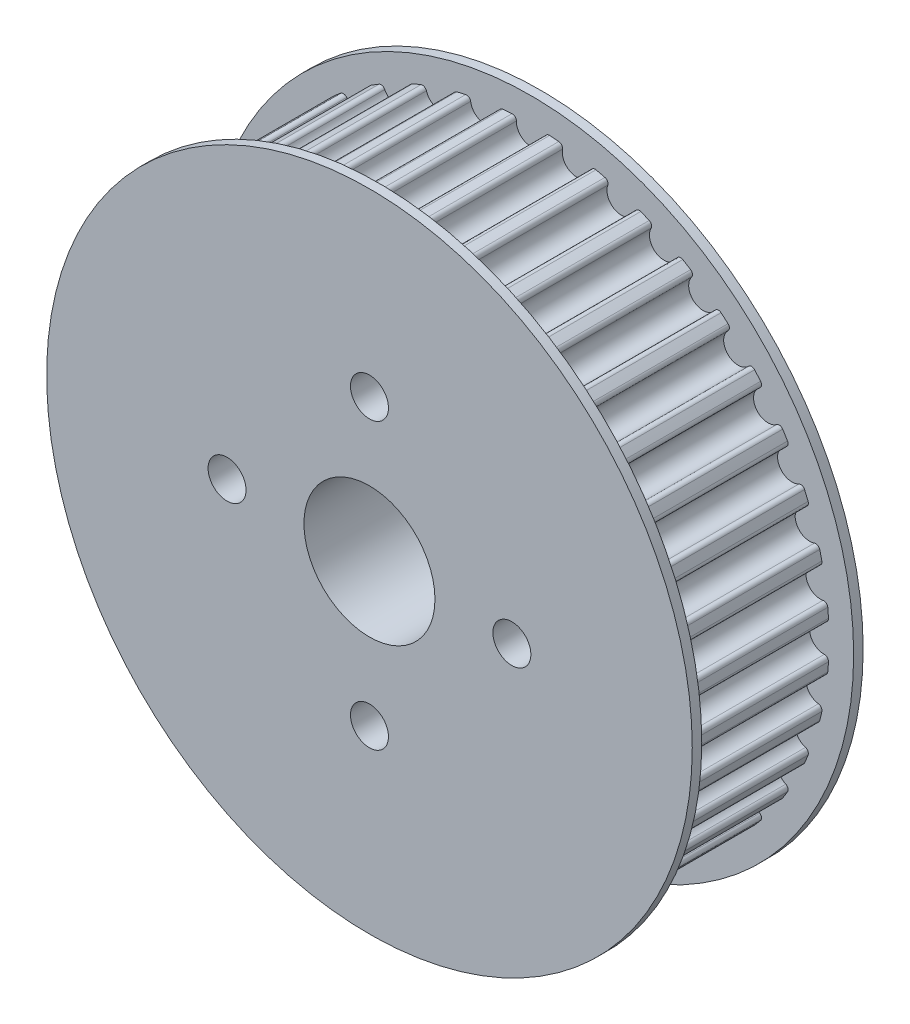
from build123d import *

# Parameters (mm, degrees)
BOSS_EXTRUDE1_DEPTH = 16
SKETCH2_R           = 34
BOSS_EXTRUDE2_DEPTH = 1
SKETCH3_R           = 6.9
SKETCH3_R_2         = 2
CUT_EXTRUDE1_DEPTH  = 52.341990612


with BuildPart() as part:
    # Sketch1 → Boss-Extrude1 (new body)
    with BuildSketch(Plane.XY):
        with BuildLine():
            ThreePointArc((0, 29.35), (1.090209609, 29.808666089), (1.524626197, 30.908763267))
            ThreePointArc((1.524626197, 30.908763267), (1.656759933, 31.228506655), (1.981649395, 31.347426779))
            ThreePointArc((1.981649395, 31.347426779), (2.464400197, 31.313173453), (2.946565936, 31.2714862))
            ThreePointArc((2.946565936, 31.2714862), (3.248852264, 31.103206271), (3.329340328, 30.766729184))
            ThreePointArc((3.329340328, 30.766729184), (3.586315414, 29.612218302), (4.591351549, 28.988652796))
            ThreePointArc((4.591351549, 28.988652796), (5.739890053, 29.271125588), (6.341051366, 30.289721017))
            ThreePointArc((6.341051366, 30.289721017), (6.521577201, 30.584857564), (6.861069941, 30.651489675))
            ThreePointArc((6.861069941, 30.651489675), (7.332518879, 30.5421392), (7.802227035, 30.425537847))
            ThreePointArc((7.802227035, 30.425537847), (8.074466935, 30.212041723), (8.101327445, 29.86711612))
            ThreePointArc((8.101327445, 29.86711612), (8.174533449, 28.686619423), (9.069648785, 27.913508753))
            ThreePointArc((9.069648785, 27.913508753), (10.248235354, 28.01283283), (11.001338804, 28.92484531))
            ThreePointArc((11.001338804, 28.92484531), (11.225811595, 29.188107774), (11.571548174, 29.200811168))
            ThreePointArc((11.571548174, 29.200811168), (12.020086611, 29.019056116), (12.46577141, 28.830411776))
            ThreePointArc((12.46577141, 28.830411776), (12.701261433, 28.57695644), (12.673832993, 28.232075534))
            ThreePointArc((12.673832993, 28.232075534), (12.56146734, 27.054660768), (13.324621167, 26.151041485))
            ThreePointArc((13.324621167, 26.151041485), (14.504235088, 26.064771158), (15.390736771, 26.847743916))
            ThreePointArc((15.390736771, 26.847743916), (15.653629251, 27.072649901), (15.997096488, 27.031111778))
            ThreePointArc((15.997096488, 27.031111778), (16.411679918, 26.781427562), (16.822367121, 26.525385284))
            ThreePointArc((16.822367121, 26.525385284), (17.015308722, 26.238211648), (16.934266711, 25.901867552))
            ThreePointArc((16.934266711, 25.901867552), (16.639096217, 24.756526576), (17.251497155, 23.744648785))
            ThreePointArc((17.251497155, 23.744648785), (18.403092419, 23.474908316), (19.401163718, 24.109561964))
            ThreePointArc((19.401163718, 24.109561964), (19.696002604, 24.290573538), (20.028743195, 24.195816705))
            ThreePointArc((20.028743195, 24.195816705), (20.399163198, 23.884351379), (20.764740323, 23.567215773))
            ThreePointArc((20.764740323, 23.567215773), (20.910382639, 23.253395005), (20.777722581, 22.933869627))
            ThreePointArc((20.777722581, 22.933869627), (20.307015323, 21.848804537), (20.753584028, 20.753584028))
            ThreePointArc((20.753584028, 20.753584028), (21.848804537, 20.307015323), (22.933869627, 20.777722581))
            ThreePointArc((22.933869627, 20.777722581), (23.253395005, 20.910382639), (23.567215773, 20.764740323))
            ThreePointArc((23.567215773, 20.764740323), (23.884351379, 20.399163198), (24.195816705, 20.028743195))
            ThreePointArc((24.195816705, 20.028743195), (24.290573538, 19.696002604), (24.109561964, 19.401163718))
            ThreePointArc((24.109561964, 19.401163718), (23.474908316, 18.403092419), (23.744648785, 17.251497155))
            ThreePointArc((23.744648785, 17.251497155), (24.756526576, 16.639096217), (25.901867552, 16.934266711))
            ThreePointArc((25.901867552, 16.934266711), (26.238211648, 17.015308722), (26.525385284, 16.822367121))
            ThreePointArc((26.525385284, 16.822367121), (26.781427562, 16.411679918), (27.031111778, 15.997096488))
            ThreePointArc((27.031111778, 15.997096488), (27.072649901, 15.653629251), (26.847743916, 15.390736771))
            ThreePointArc((26.847743916, 15.390736771), (26.064771158, 14.504235088), (26.151041485, 13.324621167))
            ThreePointArc((26.151041485, 13.324621167), (27.054660768, 12.56146734), (28.232075534, 12.673832993))
            ThreePointArc((28.232075534, 12.673832993), (28.57695644, 12.701261433), (28.830411776, 12.46577141))
            ThreePointArc((28.830411776, 12.46577141), (29.019056116, 12.020086611), (29.200811168, 11.571548174))
            ThreePointArc((29.200811168, 11.571548174), (29.188107774, 11.225811595), (28.92484531, 11.001338804))
            ThreePointArc((28.92484531, 11.001338804), (28.01283283, 10.248235354), (27.913508753, 9.069648785))
            ThreePointArc((27.913508753, 9.069648785), (28.686619423, 8.174533449), (29.86711612, 8.101327445))
            ThreePointArc((29.86711612, 8.101327445), (30.212041723, 8.074466935), (30.425537847, 7.802227035))
            ThreePointArc((30.425537847, 7.802227035), (30.5421392, 7.332518879), (30.651489675, 6.861069941))
            ThreePointArc((30.651489675, 6.861069941), (30.584857564, 6.521577201), (30.289721017, 6.341051366))
            ThreePointArc((30.289721017, 6.341051366), (29.271125588, 5.739890053), (28.988652796, 4.591351549))
            ThreePointArc((28.988652796, 4.591351549), (29.612218302, 3.586315414), (30.766729184, 3.329340328))
            ThreePointArc((30.766729184, 3.329340328), (31.103206271, 3.248852264), (31.2714862, 2.946565936))
            ThreePointArc((31.2714862, 2.946565936), (31.313173453, 2.464400197), (31.347426779, 1.981649395))
            ThreePointArc((31.347426779, 1.981649395), (31.228506655, 1.656759933), (30.908763267, 1.524626197))
            ThreePointArc((30.908763267, 1.524626197), (29.808666089, 1.090209609), (29.35, 0))
            ThreePointArc((29.35, 0), (29.808666089, -1.090209609), (30.908763267, -1.524626197))
            ThreePointArc((30.908763267, -1.524626197), (31.228506655, -1.656759933), (31.347426779, -1.981649395))
            ThreePointArc((31.347426779, -1.981649395), (31.313173453, -2.464400197), (31.2714862, -2.946565936))
            ThreePointArc((31.2714862, -2.946565936), (31.103206271, -3.248852264), (30.766729184, -3.329340328))
            ThreePointArc((30.766729184, -3.329340328), (29.612218302, -3.586315414), (28.988652796, -4.591351549))
            ThreePointArc((28.988652796, -4.591351549), (29.271125588, -5.739890053), (30.289721017, -6.341051366))
            ThreePointArc((30.289721017, -6.341051366), (30.584857564, -6.521577201), (30.651489675, -6.861069941))
            ThreePointArc((30.651489675, -6.861069941), (30.5421392, -7.332518879), (30.425537847, -7.802227035))
            ThreePointArc((30.425537847, -7.802227035), (30.212041723, -8.074466935), (29.86711612, -8.101327445))
            ThreePointArc((29.86711612, -8.101327445), (28.686619423, -8.174533449), (27.913508753, -9.069648785))
            ThreePointArc((27.913508753, -9.069648785), (28.01283283, -10.248235354), (28.92484531, -11.001338804))
            ThreePointArc((28.92484531, -11.001338804), (29.188107774, -11.225811595), (29.200811168, -11.571548174))
            ThreePointArc((29.200811168, -11.571548174), (29.019056116, -12.020086611), (28.830411776, -12.46577141))
            ThreePointArc((28.830411776, -12.46577141), (28.57695644, -12.701261433), (28.232075534, -12.673832993))
            ThreePointArc((28.232075534, -12.673832993), (27.054660768, -12.56146734), (26.151041485, -13.324621167))
            ThreePointArc((26.151041485, -13.324621167), (26.064771158, -14.504235088), (26.847743916, -15.390736771))
            ThreePointArc((26.847743916, -15.390736771), (27.072649901, -15.653629251), (27.031111778, -15.997096488))
            ThreePointArc((27.031111778, -15.997096488), (26.781427562, -16.411679918), (26.525385284, -16.822367121))
            ThreePointArc((26.525385284, -16.822367121), (26.238211648, -17.015308722), (25.901867552, -16.934266711))
            ThreePointArc((25.901867552, -16.934266711), (24.756526576, -16.639096217), (23.744648785, -17.251497155))
            ThreePointArc((23.744648785, -17.251497155), (23.474908316, -18.403092419), (24.109561964, -19.401163718))
            ThreePointArc((24.109561964, -19.401163718), (24.290573538, -19.696002604), (24.195816705, -20.028743195))
            ThreePointArc((24.195816705, -20.028743195), (23.884351379, -20.399163198), (23.567215773, -20.764740323))
            ThreePointArc((23.567215773, -20.764740323), (23.253395005, -20.910382639), (22.933869627, -20.777722581))
            ThreePointArc((22.933869627, -20.777722581), (21.848804537, -20.307015323), (20.753584028, -20.753584028))
            ThreePointArc((20.753584028, -20.753584028), (20.307015323, -21.848804537), (20.777722581, -22.933869627))
            ThreePointArc((20.777722581, -22.933869627), (20.910382639, -23.253395005), (20.764740323, -23.567215773))
            ThreePointArc((20.764740323, -23.567215773), (20.399163198, -23.884351379), (20.028743195, -24.195816705))
            ThreePointArc((20.028743195, -24.195816705), (19.696002604, -24.290573538), (19.401163718, -24.109561964))
            ThreePointArc((19.401163718, -24.109561964), (18.403092419, -23.474908316), (17.251497155, -23.744648785))
            ThreePointArc((17.251497155, -23.744648785), (16.639096217, -24.756526576), (16.934266711, -25.901867552))
            ThreePointArc((16.934266711, -25.901867552), (17.015308722, -26.238211648), (16.822367121, -26.525385284))
            ThreePointArc((16.822367121, -26.525385284), (16.411679918, -26.781427562), (15.997096488, -27.031111778))
            ThreePointArc((15.997096488, -27.031111778), (15.653629251, -27.072649901), (15.390736771, -26.847743916))
            ThreePointArc((15.390736771, -26.847743916), (14.504235088, -26.064771158), (13.324621167, -26.151041485))
            ThreePointArc((13.324621167, -26.151041485), (12.56146734, -27.054660768), (12.673832993, -28.232075534))
            ThreePointArc((12.673832993, -28.232075534), (12.701261433, -28.57695644), (12.46577141, -28.830411776))
            ThreePointArc((12.46577141, -28.830411776), (12.020086611, -29.019056116), (11.571548174, -29.200811168))
            ThreePointArc((11.571548174, -29.200811168), (11.225811595, -29.188107774), (11.001338804, -28.92484531))
            ThreePointArc((11.001338804, -28.92484531), (10.248235354, -28.01283283), (9.069648785, -27.913508753))
            ThreePointArc((9.069648785, -27.913508753), (8.174533449, -28.686619423), (8.101327445, -29.86711612))
            ThreePointArc((8.101327445, -29.86711612), (8.074466935, -30.212041723), (7.802227035, -30.425537847))
            ThreePointArc((7.802227035, -30.425537847), (7.332518879, -30.5421392), (6.861069941, -30.651489675))
            ThreePointArc((6.861069941, -30.651489675), (6.521577201, -30.584857564), (6.341051366, -30.289721017))
            ThreePointArc((6.341051366, -30.289721017), (5.739890053, -29.271125588), (4.591351549, -28.988652796))
            ThreePointArc((4.591351549, -28.988652796), (3.586315414, -29.612218302), (3.329340328, -30.766729184))
            ThreePointArc((3.329340328, -30.766729184), (3.248852264, -31.103206271), (2.946565936, -31.2714862))
            ThreePointArc((2.946565936, -31.2714862), (2.464400197, -31.313173453), (1.981649395, -31.347426779))
            ThreePointArc((1.981649395, -31.347426779), (1.656759933, -31.228506655), (1.524626197, -30.908763267))
            ThreePointArc((1.524626197, -30.908763267), (1.090209609, -29.808666089), (0, -29.35))
            ThreePointArc((0, -29.35), (-1.090209609, -29.808666089), (-1.524626197, -30.908763267))
            ThreePointArc((-1.524626197, -30.908763267), (-1.656759933, -31.228506655), (-1.981649395, -31.347426779))
            ThreePointArc((-1.981649395, -31.347426779), (-2.464400197, -31.313173453), (-2.946565936, -31.2714862))
            ThreePointArc((-2.946565936, -31.2714862), (-3.248852264, -31.103206271), (-3.329340328, -30.766729184))
            ThreePointArc((-3.329340328, -30.766729184), (-3.586315414, -29.612218302), (-4.591351549, -28.988652796))
            ThreePointArc((-4.591351549, -28.988652796), (-5.739890053, -29.271125588), (-6.341051366, -30.289721017))
            ThreePointArc((-6.341051366, -30.289721017), (-6.521577201, -30.584857564), (-6.861069941, -30.651489675))
            ThreePointArc((-6.861069941, -30.651489675), (-7.332518879, -30.5421392), (-7.802227035, -30.425537847))
            ThreePointArc((-7.802227035, -30.425537847), (-8.074466935, -30.212041723), (-8.101327445, -29.86711612))
            ThreePointArc((-8.101327445, -29.86711612), (-8.174533449, -28.686619423), (-9.069648785, -27.913508753))
            ThreePointArc((-9.069648785, -27.913508753), (-10.248235354, -28.01283283), (-11.001338804, -28.92484531))
            ThreePointArc((-11.001338804, -28.92484531), (-11.225811595, -29.188107774), (-11.571548174, -29.200811168))
            ThreePointArc((-11.571548174, -29.200811168), (-12.020086611, -29.019056116), (-12.46577141, -28.830411776))
            ThreePointArc((-12.46577141, -28.830411776), (-12.701261433, -28.57695644), (-12.673832993, -28.232075534))
            ThreePointArc((-12.673832993, -28.232075534), (-12.56146734, -27.054660768), (-13.324621167, -26.151041485))
            ThreePointArc((-13.324621167, -26.151041485), (-14.504235088, -26.064771158), (-15.390736771, -26.847743916))
            ThreePointArc((-15.390736771, -26.847743916), (-15.653629251, -27.072649901), (-15.997096488, -27.031111778))
            ThreePointArc((-15.997096488, -27.031111778), (-16.411679918, -26.781427562), (-16.822367121, -26.525385284))
            ThreePointArc((-16.822367121, -26.525385284), (-17.015308722, -26.238211648), (-16.934266711, -25.901867552))
            ThreePointArc((-16.934266711, -25.901867552), (-16.639096217, -24.756526576), (-17.251497155, -23.744648785))
            ThreePointArc((-17.251497155, -23.744648785), (-18.403092419, -23.474908316), (-19.401163718, -24.109561964))
            ThreePointArc((-19.401163718, -24.109561964), (-19.696002604, -24.290573538), (-20.028743195, -24.195816705))
            ThreePointArc((-20.028743195, -24.195816705), (-20.399163198, -23.884351379), (-20.764740323, -23.567215773))
            ThreePointArc((-20.764740323, -23.567215773), (-20.910382639, -23.253395005), (-20.777722581, -22.933869627))
            ThreePointArc((-20.777722581, -22.933869627), (-20.307015323, -21.848804537), (-20.753584028, -20.753584028))
            ThreePointArc((-20.753584028, -20.753584028), (-21.848804537, -20.307015323), (-22.933869627, -20.777722581))
            ThreePointArc((-22.933869627, -20.777722581), (-23.253395005, -20.910382639), (-23.567215773, -20.764740323))
            ThreePointArc((-23.567215773, -20.764740323), (-23.884351379, -20.399163198), (-24.195816705, -20.028743195))
            ThreePointArc((-24.195816705, -20.028743195), (-24.290573538, -19.696002604), (-24.109561964, -19.401163718))
            ThreePointArc((-24.109561964, -19.401163718), (-23.474908316, -18.403092419), (-23.744648785, -17.251497155))
            ThreePointArc((-23.744648785, -17.251497155), (-24.756526576, -16.639096217), (-25.901867552, -16.934266711))
            ThreePointArc((-25.901867552, -16.934266711), (-26.238211648, -17.015308722), (-26.525385284, -16.822367121))
            ThreePointArc((-26.525385284, -16.822367121), (-26.781427562, -16.411679918), (-27.031111778, -15.997096488))
            ThreePointArc((-27.031111778, -15.997096488), (-27.072649901, -15.653629251), (-26.847743916, -15.390736771))
            ThreePointArc((-26.847743916, -15.390736771), (-26.064771158, -14.504235088), (-26.151041485, -13.324621167))
            ThreePointArc((-26.151041485, -13.324621167), (-27.054660768, -12.56146734), (-28.232075534, -12.673832993))
            ThreePointArc((-28.232075534, -12.673832993), (-28.57695644, -12.701261433), (-28.830411776, -12.46577141))
            ThreePointArc((-28.830411776, -12.46577141), (-29.019056116, -12.020086611), (-29.200811168, -11.571548174))
            ThreePointArc((-29.200811168, -11.571548174), (-29.188107774, -11.225811595), (-28.92484531, -11.001338804))
            ThreePointArc((-28.92484531, -11.001338804), (-28.01283283, -10.248235354), (-27.913508753, -9.069648785))
            ThreePointArc((-27.913508753, -9.069648785), (-28.686619423, -8.174533449), (-29.86711612, -8.101327445))
            ThreePointArc((-29.86711612, -8.101327445), (-30.212041723, -8.074466935), (-30.425537847, -7.802227035))
            ThreePointArc((-30.425537847, -7.802227035), (-30.5421392, -7.332518879), (-30.651489675, -6.861069941))
            ThreePointArc((-30.651489675, -6.861069941), (-30.584857564, -6.521577201), (-30.289721017, -6.341051366))
            ThreePointArc((-30.289721017, -6.341051366), (-29.271125588, -5.739890053), (-28.988652796, -4.591351549))
            ThreePointArc((-28.988652796, -4.591351549), (-29.612218302, -3.586315414), (-30.766729184, -3.329340328))
            ThreePointArc((-30.766729184, -3.329340328), (-31.103206271, -3.248852264), (-31.2714862, -2.946565936))
            ThreePointArc((-31.2714862, -2.946565936), (-31.313173453, -2.464400197), (-31.347426779, -1.981649395))
            ThreePointArc((-31.347426779, -1.981649395), (-31.228506655, -1.656759933), (-30.908763267, -1.524626197))
            ThreePointArc((-30.908763267, -1.524626197), (-29.808666089, -1.090209609), (-29.35, 0))
            ThreePointArc((-29.35, 0), (-29.808666089, 1.090209609), (-30.908763267, 1.524626197))
            ThreePointArc((-30.908763267, 1.524626197), (-31.228506655, 1.656759933), (-31.347426779, 1.981649395))
            ThreePointArc((-31.347426779, 1.981649395), (-31.313173453, 2.464400197), (-31.2714862, 2.946565936))
            ThreePointArc((-31.2714862, 2.946565936), (-31.103206271, 3.248852264), (-30.766729184, 3.329340328))
            ThreePointArc((-30.766729184, 3.329340328), (-29.612218302, 3.586315414), (-28.988652796, 4.591351549))
            ThreePointArc((-28.988652796, 4.591351549), (-29.271125588, 5.739890053), (-30.289721017, 6.341051366))
            ThreePointArc((-30.289721017, 6.341051366), (-30.584857564, 6.521577201), (-30.651489675, 6.861069941))
            ThreePointArc((-30.651489675, 6.861069941), (-30.5421392, 7.332518879), (-30.425537847, 7.802227035))
            ThreePointArc((-30.425537847, 7.802227035), (-30.212041723, 8.074466935), (-29.86711612, 8.101327445))
            ThreePointArc((-29.86711612, 8.101327445), (-28.686619423, 8.174533449), (-27.913508753, 9.069648785))
            ThreePointArc((-27.913508753, 9.069648785), (-28.01283283, 10.248235354), (-28.92484531, 11.001338804))
            ThreePointArc((-28.92484531, 11.001338804), (-29.188107774, 11.225811595), (-29.200811168, 11.571548174))
            ThreePointArc((-29.200811168, 11.571548174), (-29.019056116, 12.020086611), (-28.830411776, 12.46577141))
            ThreePointArc((-28.830411776, 12.46577141), (-28.57695644, 12.701261433), (-28.232075534, 12.673832993))
            ThreePointArc((-28.232075534, 12.673832993), (-27.054660768, 12.56146734), (-26.151041485, 13.324621167))
            ThreePointArc((-26.151041485, 13.324621167), (-26.064771158, 14.504235088), (-26.847743916, 15.390736771))
            ThreePointArc((-26.847743916, 15.390736771), (-27.072649901, 15.653629251), (-27.031111778, 15.997096488))
            ThreePointArc((-27.031111778, 15.997096488), (-26.781427562, 16.411679918), (-26.525385284, 16.822367121))
            ThreePointArc((-26.525385284, 16.822367121), (-26.238211648, 17.015308722), (-25.901867552, 16.934266711))
            ThreePointArc((-25.901867552, 16.934266711), (-24.756526576, 16.639096217), (-23.744648785, 17.251497155))
            ThreePointArc((-23.744648785, 17.251497155), (-23.474908316, 18.403092419), (-24.109561964, 19.401163718))
            ThreePointArc((-24.109561964, 19.401163718), (-24.290573538, 19.696002604), (-24.195816705, 20.028743195))
            ThreePointArc((-24.195816705, 20.028743195), (-23.884351379, 20.399163198), (-23.567215773, 20.764740323))
            ThreePointArc((-23.567215773, 20.764740323), (-23.253395005, 20.910382639), (-22.933869627, 20.777722581))
            ThreePointArc((-22.933869627, 20.777722581), (-21.848804537, 20.307015323), (-20.753584028, 20.753584028))
            ThreePointArc((-20.753584028, 20.753584028), (-20.307015323, 21.848804537), (-20.777722581, 22.933869627))
            ThreePointArc((-20.777722581, 22.933869627), (-20.910382639, 23.253395005), (-20.764740323, 23.567215773))
            ThreePointArc((-20.764740323, 23.567215773), (-20.399163198, 23.884351379), (-20.028743195, 24.195816705))
            ThreePointArc((-20.028743195, 24.195816705), (-19.696002604, 24.290573538), (-19.401163718, 24.109561964))
            ThreePointArc((-19.401163718, 24.109561964), (-18.403092419, 23.474908316), (-17.251497155, 23.744648785))
            ThreePointArc((-17.251497155, 23.744648785), (-16.639096217, 24.756526576), (-16.934266711, 25.901867552))
            ThreePointArc((-16.934266711, 25.901867552), (-17.015308722, 26.238211648), (-16.822367121, 26.525385284))
            ThreePointArc((-16.822367121, 26.525385284), (-16.411679918, 26.781427562), (-15.997096488, 27.031111778))
            ThreePointArc((-15.997096488, 27.031111778), (-15.653629251, 27.072649901), (-15.390736771, 26.847743916))
            ThreePointArc((-15.390736771, 26.847743916), (-14.504235088, 26.064771158), (-13.324621167, 26.151041485))
            ThreePointArc((-13.324621167, 26.151041485), (-12.56146734, 27.054660768), (-12.673832993, 28.232075534))
            ThreePointArc((-12.673832993, 28.232075534), (-12.701261433, 28.57695644), (-12.46577141, 28.830411776))
            ThreePointArc((-12.46577141, 28.830411776), (-12.020086611, 29.019056116), (-11.571548174, 29.200811168))
            ThreePointArc((-11.571548174, 29.200811168), (-11.225811595, 29.188107774), (-11.001338804, 28.92484531))
            ThreePointArc((-11.001338804, 28.92484531), (-10.248235354, 28.01283283), (-9.069648785, 27.913508753))
            ThreePointArc((-9.069648785, 27.913508753), (-8.174533449, 28.686619423), (-8.101327445, 29.86711612))
            ThreePointArc((-8.101327445, 29.86711612), (-8.074466935, 30.212041723), (-7.802227035, 30.425537847))
            ThreePointArc((-7.802227035, 30.425537847), (-7.332518879, 30.5421392), (-6.861069941, 30.651489675))
            ThreePointArc((-6.861069941, 30.651489675), (-6.521577201, 30.584857564), (-6.341051366, 30.289721017))
            ThreePointArc((-6.341051366, 30.289721017), (-5.739890053, 29.271125588), (-4.591351549, 28.988652796))
            ThreePointArc((-4.591351549, 28.988652796), (-3.586315414, 29.612218302), (-3.329340328, 30.766729184))
            ThreePointArc((-3.329340328, 30.766729184), (-3.248852264, 31.103206271), (-2.946565936, 31.2714862))
            ThreePointArc((-2.946565936, 31.2714862), (-2.464400197, 31.313173453), (-1.981649395, 31.347426779))
            ThreePointArc((-1.981649395, 31.347426779), (-1.656759933, 31.228506655), (-1.524626197, 30.908763267))
            ThreePointArc((-1.524626197, 30.908763267), (-1.090209609, 29.808666089), (0, 29.35))
        make_face()
    extrude(amount=BOSS_EXTRUDE1_DEPTH)

    # Sketch2 → Boss-Extrude2 (add)
    with BuildSketch(Plane.XY.offset(16)):
        Circle(SKETCH2_R)
    boss_extrude2 = extrude(amount=BOSS_EXTRUDE2_DEPTH)

    # Mirror1: Boss-Extrude2 across plane
    add(boss_extrude2.mirror(Plane(origin=(0, 0, 8), x_dir=(1, 0, 0), z_dir=(0, 0, -1))))

    # Sketch3 → Cut-Extrude1 (cut, through all)
    with BuildSketch(Plane.XY.offset(17)):
        Circle(SKETCH3_R)
        with Locations((15, 0)):
            Circle(SKETCH3_R_2)
        with Locations((0, -15)):
            Circle(SKETCH3_R_2)
        with Locations((-15, 0)):
            Circle(SKETCH3_R_2)
        with Locations((0, 15)):
            Circle(SKETCH3_R_2)
    extrude(amount=-CUT_EXTRUDE1_DEPTH, mode=Mode.SUBTRACT)


solid = part.part
